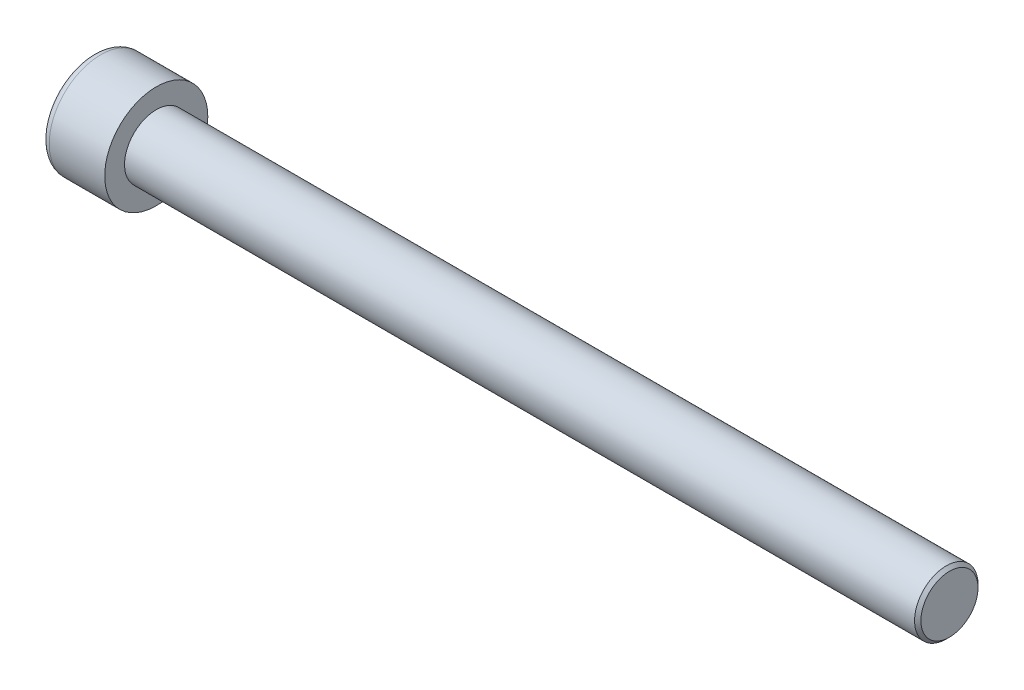
from build123d import *

# Parameters (mm, degrees)
SKETCH1_R           = 6.5
BASEHEAD_DEPTH      = 8
SKETCH2_R           = 4
BASEBODY_DEPTH      = 100
HEXAGONSOCKET_DEPTH = 4
TOPFILLET_R         = 1
CHAMFER1_SIZE       = 0.4


with BuildPart() as part:
    # Sketch1 → BaseHead (new body)
    with BuildSketch(Plane(origin=(0, 0, 0), x_dir=(0, 0, -1), z_dir=(1, 0, 0))):
        Circle(SKETCH1_R)
    extrude(amount=BASEHEAD_DEPTH)

    # Sketch2 → BaseBody (add)
    with BuildSketch(Plane(origin=(8, 0, 0), x_dir=(0, 0, -1), z_dir=(1, 0, 0))):
        Circle(SKETCH2_R)
    extrude(amount=BASEBODY_DEPTH)

    # Sketch3 → HexagonSocket (cut)
    with BuildSketch(Plane(origin=(0, 0, 0), x_dir=(0, 0, -1), z_dir=(1, 0, 0))):
        Polygon((3.464101615, 0), (1.732050808, 3), (-1.732050808, 3), (-3.464101615, 0), (-1.732050808, -3), (1.732050808, -3), align=None)
    extrude(amount=HEXAGONSOCKET_DEPTH, mode=Mode.SUBTRACT)

    # Sketch4 → Cut-Revolve1 (revolve, cut)
    with BuildSketch(Plane(origin=(-4.19613823, 0.75, 0), x_dir=(-1, 0, 0), z_dir=(0, 0, 1)), mode=Mode.PRIVATE) as cut_revolve1_sk:
        Polygon((-8.19613823, 3.75), (-9.928189037, 0.75), (-8.19613823, 0.75), align=None)
    revolve(cut_revolve1_sk.sketch.rotate(Axis((0.838992387, 0, 0), (-1, 0, 0)), 90), axis=Axis((0.838992387, 0, 0), (-1, 0, 0)), mode=Mode.SUBTRACT)

    # TopFillet
    topfillet_edges = [part.edges().sort_by_distance(p)[0] for p in [
        (0, 0, 6.5),
    ]]
    fillet(topfillet_edges, radius=TOPFILLET_R)

    # Chamfer1
    chamfer1_edges = [part.edges().sort_by_distance(p)[0] for p in [
        (108, 0, 4),
    ]]
    chamfer(chamfer1_edges, length=CHAMFER1_SIZE)


solid = part.part
